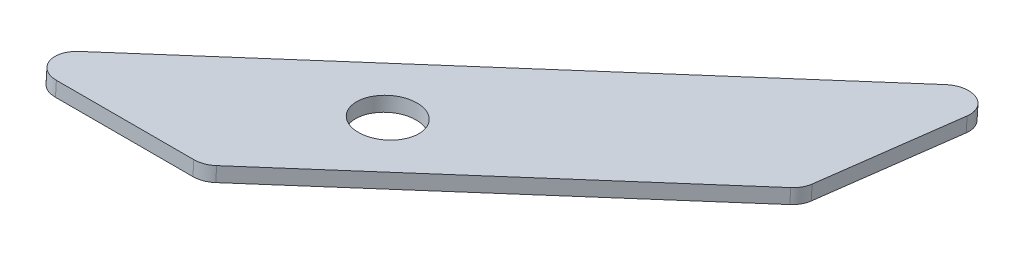
from build123d import *

# Parameters (mm, degrees)
SKETCH1_R           = 3.2639
BOSS_EXTRUDE1_DEPTH = 1.5875
FILLET1_R           = 2.54


with BuildPart() as part:
    # Sketch1 → Boss-Extrude1 (new body)
    with BuildSketch(Plane(origin=(0, 40.718386742, -2.659285129), x_dir=(-1, 0, 0), z_dir=(0, -0.9978741525202128, 0.06517035930595418))):
        Polygon((-171.13938014, -1400.231037764), (-137.793551766, -1433.576866138), (-115.342911464, -1433.576866138), (-172.599947484, -1376.319830118), align=None)
        with Locations((-142.443231615, -1417.701866138)):
            Circle(SKETCH1_R, mode=Mode.SUBTRACT)
    extrude(amount=BOSS_EXTRUDE1_DEPTH)

    # Fillet1
    fillet1_edges = [part.edges().sort_by_distance(p)[0] for p in [
        (172.599947484, 129.621581982, 1370.786427919),
        (137.793551766, 133.353043592, 1427.921744213),
        (171.13938014, 131.179883976, 1394.646803985),
        (115.342911464, 133.353043592, 1427.921744213),
    ]]
    fillet(fillet1_edges, radius=FILLET1_R)


solid = part.part
